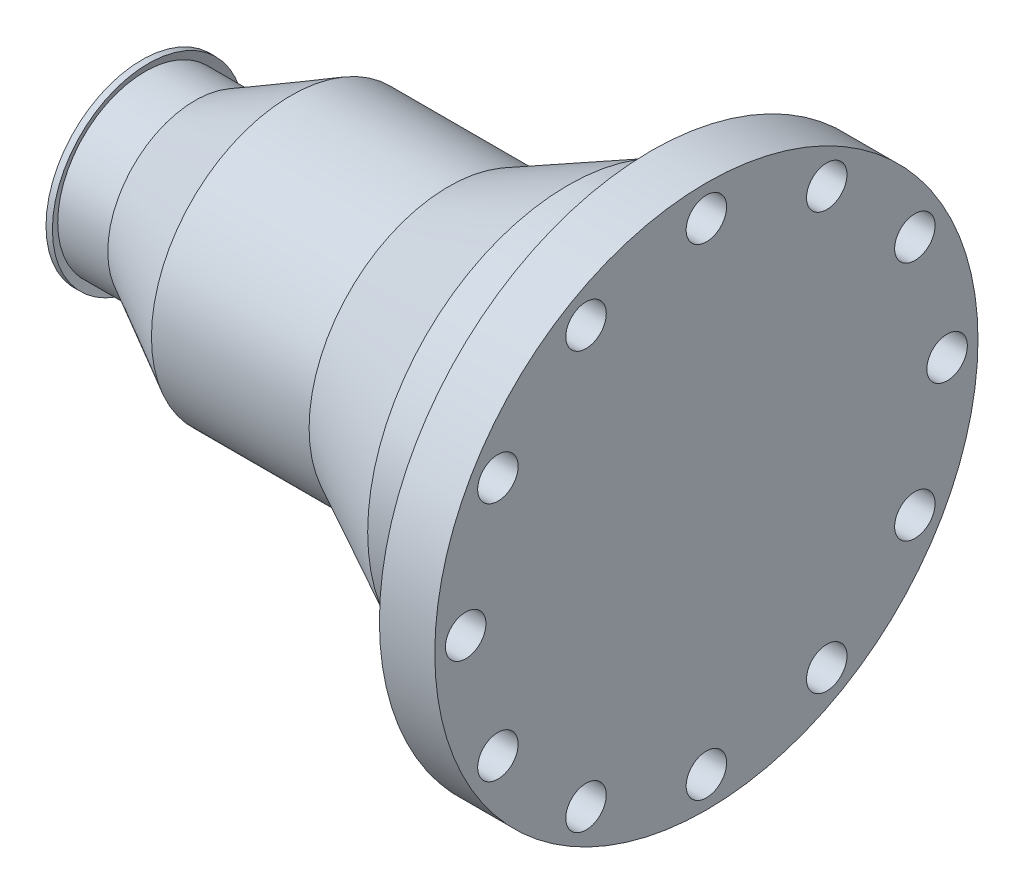
from build123d import *

# Parameters (mm, degrees)
SKETCH_3_R           = 9.5
CUT_EXTRUDE_1_DEPTH  = 321.526909947
SKETCH_4_R           = 9.5
CUT_EXTRUDE_2_DEPTH  = 321.526909947
SKETCH_5_R           = 9.5
CUT_EXTRUDE_3_DEPTH  = 321.526909947
SKETCH_6_R           = 9.5
CUT_EXTRUDE_4_DEPTH  = 321.526909947
SKETCH_7_R           = 9.5
CUT_EXTRUDE_5_DEPTH  = 321.526909947
SKETCH_8_R           = 9.5
CUT_EXTRUDE_6_DEPTH  = 321.526909947
SKETCH_9_R           = 9.5
CUT_EXTRUDE_7_DEPTH  = 321.526909947
SKETCH_10_R          = 9.5
CUT_EXTRUDE_8_DEPTH  = 321.526909947
SKETCH_11_R          = 9.5
CUT_EXTRUDE_9_DEPTH  = 321.526909947
SKETCH_12_R          = 9.5
CUT_EXTRUDE_10_DEPTH = 321.526909947
SKETCH_13_R          = 9.5
CUT_EXTRUDE_11_DEPTH = 321.526909947
SKETCH_14_R          = 9.5
CUT_EXTRUDE_12_DEPTH = 321.526909947


with BuildPart() as part:
    # Эскиз1 → Повернуть1 (revolve)
    with BuildSketch(Plane.XY, mode=Mode.PRIVATE) as revolve_1_sk:
        Polygon((0, 0), (265, 0), (265, 127.5), (239, 127.5), (239, 100), (239, 95), (220, 95), (220, 94), (200, 94), (144, 65.5), (70, 65.5), (25, 41), (1.5, 41), (3, 45), (0, 45), align=None)
    revolve(revolve_1_sk.sketch.rotate(Axis((0, 0, 0), (1, 0, 0)), 90), axis=Axis((0, 0, 0), (1, 0, 0)))

    # Эскиз2 → Вырез-Повернуть1 (revolve, cut)
    with BuildSketch(Plane.XY, mode=Mode.PRIVATE) as cut_revolve_1_sk:
        with BuildLine():
            Line((0, 0), (200, 0))
            Line((200, 0), (200, 55))
            Line((200, 55), (192.669873, 55))
            ThreePointArc((192.669873, 55), (191.273625348, 54.108499061), (191.669873, 52.5))
            Line((191.669873, 52.5), (188.5, 52.5))
            ThreePointArc((188.5, 52.5), (187.75, 52.602347572), (187, 52.5))
            Line((187, 52.5), (177, 52.5))
            Line((177, 52.5), (95, 52.5))
            Line((95, 52.5), (90, 52.5))
            ThreePointArc((90, 52.5), (79.13262933, 46.740617582), (70, 38.502577))
            Line((70, 38.502577), (42, 31))
            Line((42, 31), (0, 31))
            Line((0, 31), (0, 0))
        make_face()
    revolve(cut_revolve_1_sk.sketch.rotate(Axis((0, 0, 0), (1, 0, 0)), 90), axis=Axis((0, 0, 0), (1, 0, 0)), mode=Mode.SUBTRACT)

    # Эскиз3 → Вырез-Вытянуть1 (cut, through all)
    with BuildSketch(Plane(origin=(0, 0, 0), x_dir=(0, 0, -1), z_dir=(1, 0, 0))):
        with Locations((0, 113)):
            Circle(SKETCH_3_R)
    extrude(amount=CUT_EXTRUDE_1_DEPTH, mode=Mode.SUBTRACT)

    # Эскиз4 → Вырез-Вытянуть2 (cut, through all)
    with BuildSketch(Plane(origin=(0, 0, 0), x_dir=(0, 0, -1), z_dir=(1, 0, 0))):
        with Locations((-56.5, 97.860870628)):
            Circle(SKETCH_4_R)
    extrude(amount=CUT_EXTRUDE_2_DEPTH, mode=Mode.SUBTRACT)

    # Эскиз5 → Вырез-Вытянуть3 (cut, through all)
    with BuildSketch(Plane(origin=(0, 0, 0), x_dir=(0, 0, -1), z_dir=(1, 0, 0))):
        with Locations((-97.860870628, 56.5)):
            Circle(SKETCH_5_R)
    extrude(amount=CUT_EXTRUDE_3_DEPTH, mode=Mode.SUBTRACT)

    # Эскиз6 → Вырез-Вытянуть4 (cut, through all)
    with BuildSketch(Plane(origin=(0, 0, 0), x_dir=(0, 0, -1), z_dir=(1, 0, 0))):
        with Locations((-113, 0)):
            Circle(SKETCH_6_R)
    extrude(amount=CUT_EXTRUDE_4_DEPTH, mode=Mode.SUBTRACT)

    # Эскиз7 → Вырез-Вытянуть5 (cut, through all)
    with BuildSketch(Plane(origin=(0, 0, 0), x_dir=(0, 0, -1), z_dir=(1, 0, 0))):
        with Locations((-97.860870628, -56.5)):
            Circle(SKETCH_7_R)
    extrude(amount=CUT_EXTRUDE_5_DEPTH, mode=Mode.SUBTRACT)

    # Эскиз8 → Вырез-Вытянуть6 (cut, through all)
    with BuildSketch(Plane(origin=(0, 0, 0), x_dir=(0, 0, -1), z_dir=(1, 0, 0))):
        with Locations((-56.5, -97.860870628)):
            Circle(SKETCH_8_R)
    extrude(amount=CUT_EXTRUDE_6_DEPTH, mode=Mode.SUBTRACT)

    # Эскиз9 → Вырез-Вытянуть7 (cut, through all)
    with BuildSketch(Plane(origin=(0, 0, 0), x_dir=(0, 0, -1), z_dir=(1, 0, 0))):
        with Locations((0, -113)):
            Circle(SKETCH_9_R)
    extrude(amount=CUT_EXTRUDE_7_DEPTH, mode=Mode.SUBTRACT)

    # Эскиз10 → Вырез-Вытянуть8 (cut, through all)
    with BuildSketch(Plane(origin=(0, 0, 0), x_dir=(0, 0, -1), z_dir=(1, 0, 0))):
        with Locations((56.5, -97.860870628)):
            Circle(SKETCH_10_R)
    extrude(amount=CUT_EXTRUDE_8_DEPTH, mode=Mode.SUBTRACT)

    # Эскиз11 → Вырез-Вытянуть9 (cut, through all)
    with BuildSketch(Plane(origin=(0, 0, 0), x_dir=(0, 0, -1), z_dir=(1, 0, 0))):
        with Locations((97.860870628, -56.5)):
            Circle(SKETCH_11_R)
    extrude(amount=CUT_EXTRUDE_9_DEPTH, mode=Mode.SUBTRACT)

    # Эскиз12 → Вырез-Вытянуть10 (cut, through all)
    with BuildSketch(Plane(origin=(0, 0, 0), x_dir=(0, 0, -1), z_dir=(1, 0, 0))):
        with Locations((113, 0)):
            Circle(SKETCH_12_R)
    extrude(amount=CUT_EXTRUDE_10_DEPTH, mode=Mode.SUBTRACT)

    # Эскиз13 → Вырез-Вытянуть11 (cut, through all)
    with BuildSketch(Plane(origin=(0, 0, 0), x_dir=(0, 0, -1), z_dir=(1, 0, 0))):
        with Locations((97.860870628, 56.5)):
            Circle(SKETCH_13_R)
    extrude(amount=CUT_EXTRUDE_11_DEPTH, mode=Mode.SUBTRACT)

    # Эскиз14 → Вырез-Вытянуть12 (cut, through all)
    with BuildSketch(Plane(origin=(0, 0, 0), x_dir=(0, 0, -1), z_dir=(1, 0, 0))):
        with Locations((56.5, 97.860870628)):
            Circle(SKETCH_14_R)
    extrude(amount=CUT_EXTRUDE_12_DEPTH, mode=Mode.SUBTRACT)


solid = part.part
